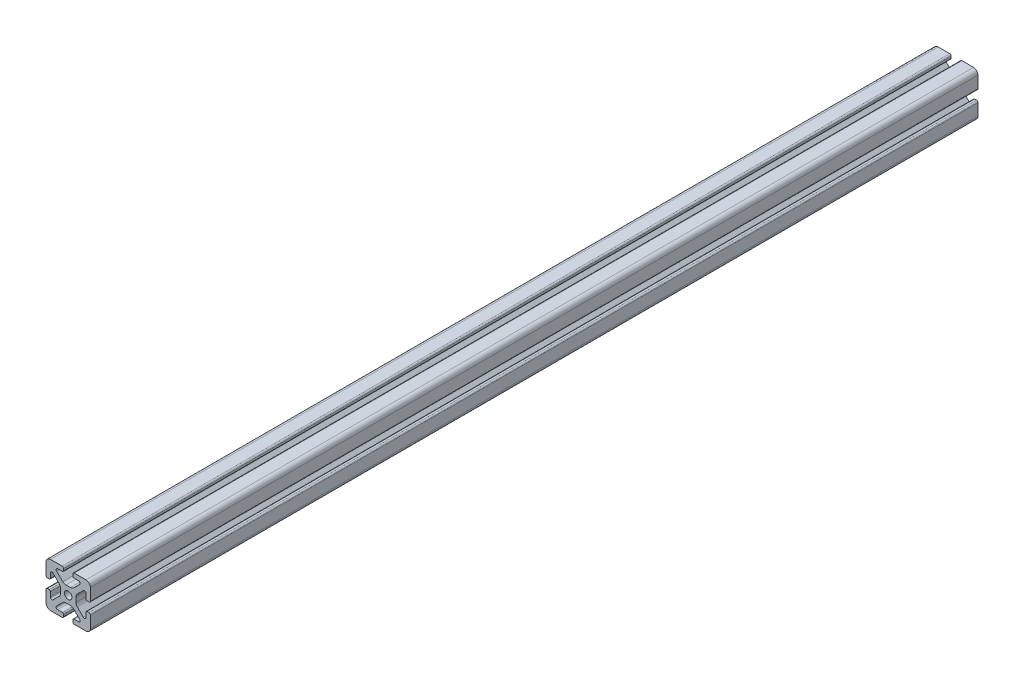
from build123d import *

# Parameters (mm, degrees)
BOSS_EXTRU_1_DEPTH = 600


with BuildPart() as part:
    # Esquisse1 → Boss.-Extru.1 (new body)
    with BuildSketch(Plane.XY):
        with BuildLine():
            Line((-5.250000005, 1.60319626), (-5.250000005, -1.60319626))
            ThreePointArc((-5.250000005, -1.60319626), (-5.478361407, -2.751246556), (-6.128679661, -3.724516602))
            Line((-6.128679661, -3.724516602), (-10.254720421, -7.850557362))
            ThreePointArc((-10.254720421, -7.850557362), (-11.36887955, -8.072177392), (-12, -7.12763889))
            Line((-12, -7.12763889), (-12, -3.9))
            ThreePointArc((-12, -3.9), (-12.234314575, -3.334314575), (-12.8, -3.1))
            Line((-12.8, -3.1), (-14, -3.1))
            ThreePointArc((-14, -3.1), (-14.707106781, -3.392893219), (-15, -4.1))
            Line((-15, -4.1), (-15, -12))
            ThreePointArc((-15, -12), (-14.121320344, -14.121320344), (-12, -15))
            Line((-12, -15), (-4.1, -15))
            ThreePointArc((-4.1, -15), (-3.392893219, -14.707106781), (-3.1, -14))
            Line((-3.1, -14), (-3.1, -12.8))
            ThreePointArc((-3.1, -12.8), (-3.334314575, -12.234314575), (-3.9, -12))
            Line((-3.9, -12), (-7.12763889, -12))
            ThreePointArc((-7.12763889, -12), (-8.072177392, -11.36887955), (-7.850557362, -10.254720421))
            Line((-7.850557362, -10.254720421), (-3.724516602, -6.128679661))
            ThreePointArc((-3.724516602, -6.128679661), (-2.751246556, -5.478361407), (-1.60319626, -5.250000005))
            Line((-1.60319626, -5.250000005), (1.60319626, -5.250000005))
            ThreePointArc((1.60319626, -5.250000005), (2.751246556, -5.478361407), (3.724516602, -6.128679661))
            Line((3.724516602, -6.128679661), (7.850557362, -10.254720421))
            ThreePointArc((7.850557362, -10.254720421), (8.072177392, -11.36887955), (7.12763889, -12))
            Line((7.12763889, -12), (3.9, -12))
            ThreePointArc((3.9, -12), (3.334314575, -12.234314575), (3.1, -12.8))
            Line((3.1, -12.8), (3.1, -14))
            ThreePointArc((3.1, -14), (3.392893219, -14.707106781), (4.1, -15))
            Line((4.1, -15), (12, -15))
            ThreePointArc((12, -15), (14.121320343, -14.121320344), (15, -12))
            Line((15, -12), (15, -4.1))
            ThreePointArc((15, -4.1), (14.707106781, -3.392893219), (14, -3.1))
            Line((14, -3.1), (12.8, -3.1))
            ThreePointArc((12.8, -3.1), (12.234314575, -3.334314575), (12, -3.9))
            Line((12, -3.9), (12, -7.12763889))
            ThreePointArc((12, -7.12763889), (11.36887955, -8.072177392), (10.254720421, -7.850557362))
            Line((10.254720421, -7.850557362), (6.128679661, -3.724516602))
            ThreePointArc((6.128679661, -3.724516602), (5.478361407, -2.751246556), (5.250000005, -1.60319626))
            Line((5.250000005, -1.60319626), (5.250000005, 1.60319626))
            ThreePointArc((5.250000005, 1.60319626), (5.478361407, 2.751246556), (6.128679661, 3.724516602))
            Line((6.128679661, 3.724516602), (10.254720421, 7.850557362))
            ThreePointArc((10.254720421, 7.850557362), (11.36887955, 8.072177392), (12, 7.12763889))
            Line((12, 7.12763889), (12, 3.9))
            ThreePointArc((12, 3.9), (12.234314575, 3.334314575), (12.8, 3.1))
            Line((12.8, 3.1), (14, 3.1))
            ThreePointArc((14, 3.1), (14.707106781, 3.392893219), (15, 4.1))
            Line((15, 4.1), (15, 12))
            ThreePointArc((15, 12), (14.121320343, 14.121320343), (12, 15))
            Line((12, 15), (4.1, 15))
            ThreePointArc((4.1, 15), (3.392893219, 14.707106781), (3.1, 14))
            Line((3.1, 14), (3.1, 12.8))
            ThreePointArc((3.1, 12.8), (3.334314575, 12.234314575), (3.9, 12))
            Line((3.9, 12), (7.12763889, 12))
            ThreePointArc((7.12763889, 12), (8.072177392, 11.36887955), (7.850557362, 10.254720421))
            Line((7.850557362, 10.254720421), (3.724516602, 6.128679661))
            ThreePointArc((3.724516602, 6.128679661), (2.751246556, 5.478361407), (1.60319626, 5.250000005))
            Line((1.60319626, 5.250000005), (-1.60319626, 5.250000005))
            ThreePointArc((-1.60319626, 5.250000005), (-2.751246556, 5.478361407), (-3.724516602, 6.128679661))
            Line((-3.724516602, 6.128679661), (-7.850557362, 10.254720421))
            ThreePointArc((-7.850557362, 10.254720421), (-8.072177392, 11.36887955), (-7.12763889, 12))
            Line((-7.12763889, 12), (-3.9, 12))
            ThreePointArc((-3.9, 12), (-3.334314575, 12.234314575), (-3.1, 12.8))
            Line((-3.1, 12.8), (-3.1, 14))
            ThreePointArc((-3.1, 14), (-3.392893219, 14.707106781), (-4.1, 15))
            Line((-4.1, 15), (-12, 15))
            ThreePointArc((-12, 15), (-14.121320344, 14.121320343), (-15, 12))
            Line((-15, 12), (-15, 4.1))
            ThreePointArc((-15, 4.1), (-14.707106781, 3.392893219), (-14, 3.1))
            Line((-14, 3.1), (-12.8, 3.1))
            ThreePointArc((-12.8, 3.1), (-12.234314575, 3.334314575), (-12, 3.9))
            Line((-12, 3.9), (-12, 7.12763889))
            ThreePointArc((-12, 7.12763889), (-11.36887955, 8.072177392), (-10.254720421, 7.850557362))
            Line((-10.254720421, 7.850557362), (-6.128679661, 3.724516602))
            ThreePointArc((-6.128679661, 3.724516602), (-5.478361407, 2.751246556), (-5.250000005, 1.60319626))
        make_face()
        with BuildLine():
            ThreePointArc((-2.5, 0), (0, -2.5), (2.5, 0))
            ThreePointArc((2.5, 0), (0, 2.5), (-2.5, 0))
        make_face(mode=Mode.SUBTRACT)
    extrude(amount=BOSS_EXTRU_1_DEPTH)


solid = part.part
